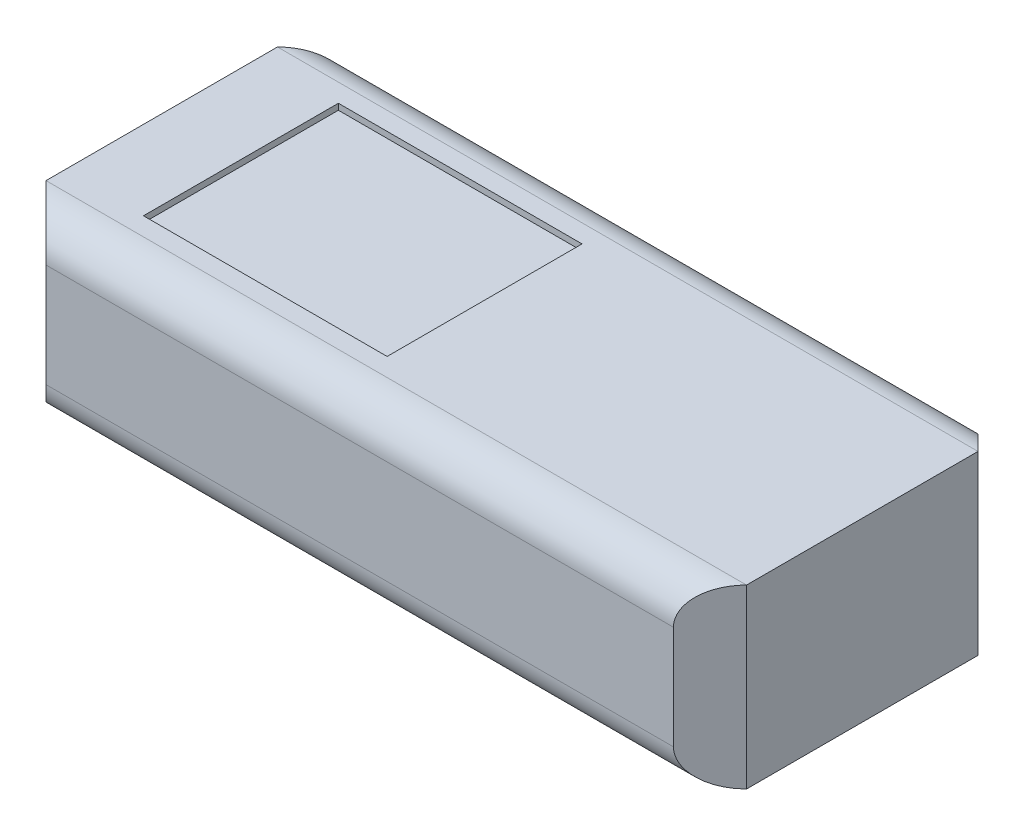
from build123d import *

# Parameters (mm, degrees)
SKETCH1_W           = 115
SKETCH1_H           = 50
BOSS_EXTRUDE1_DEPTH = 29
CHAMFER1_SIZE       = 6
FILLET1_R           = 6
SKETCH2_W           = 40
SKETCH2_H           = 32
CUT_EXTRUDE1_DEPTH  = 1
CUT_EXTRUDE2_DEPTH  = 4
SKETCH4_R           = 2.031264326
CUT_EXTRUDE3_DEPTH  = 4


with BuildPart() as part:
    # Sketch1 → Boss-Extrude1 (new body)
    with BuildSketch(Plane(origin=(0, 0, 0), x_dir=(1, 0, 0), z_dir=(0, 1, 0))):
        Rectangle(SKETCH1_W, SKETCH1_H)
    extrude(amount=BOSS_EXTRUDE1_DEPTH)

    # Chamfer1
    chamfer1_edges = [part.edges().sort_by_distance(p)[0] for p in [
        (-57.5, 14.5, -25),
        (57.5, 14.5, -25),
        (57.5, 14.5, 25),
        (-57.5, 14.5, 25),
    ]]
    chamfer(chamfer1_edges, length=CHAMFER1_SIZE)

    # Fillet1
    fillet1_edges = [part.edges().sort_by_distance(p)[0] for p in [
        (0, 0, 25),
        (0, 0, -25),
        (0, 29, -25),
        (0, 29, 25),
    ]]
    fillet(fillet1_edges, radius=FILLET1_R)

    # Sketch2 → Cut-Extrude1 (cut)
    with BuildSketch(Plane(origin=(0, 29, 0), x_dir=(1, 0, 0), z_dir=(0, 1, 0))):
        with Locations((-24.5, 0)):
            Rectangle(SKETCH2_W, SKETCH2_H)
    extrude(amount=-CUT_EXTRUDE1_DEPTH, mode=Mode.SUBTRACT)

    # Sketch3 → Cut-Extrude2 (cut)
    with BuildSketch(Plane.ZY.offset(57.5)):
        with BuildLine():
            Line((-8.750173975, 13.326246728), (-4.367676958, 12.116929263))
            ThreePointArc((-4.367676958, 12.116929263), (13.18123027, 9.336320138), (-2.589295615, 17.520844884))
            Line((-2.589295615, 17.520844884), (-7.046459278, 18.931908537))
            ThreePointArc((-7.046459278, 18.931908537), (-10.774449394, 17.003213431), (-8.750173975, 13.326246728))
        make_face()
    extrude(amount=-CUT_EXTRUDE2_DEPTH, mode=Mode.SUBTRACT)

    # Sketch4 → Cut-Extrude3 (cut)
    with BuildSketch(Plane.ZY.offset(53.5)):
        with Locations((-2.116830312, 14.069543065)):
            Circle(SKETCH4_R)
    extrude(amount=-CUT_EXTRUDE3_DEPTH, mode=Mode.SUBTRACT)


solid = part.part
